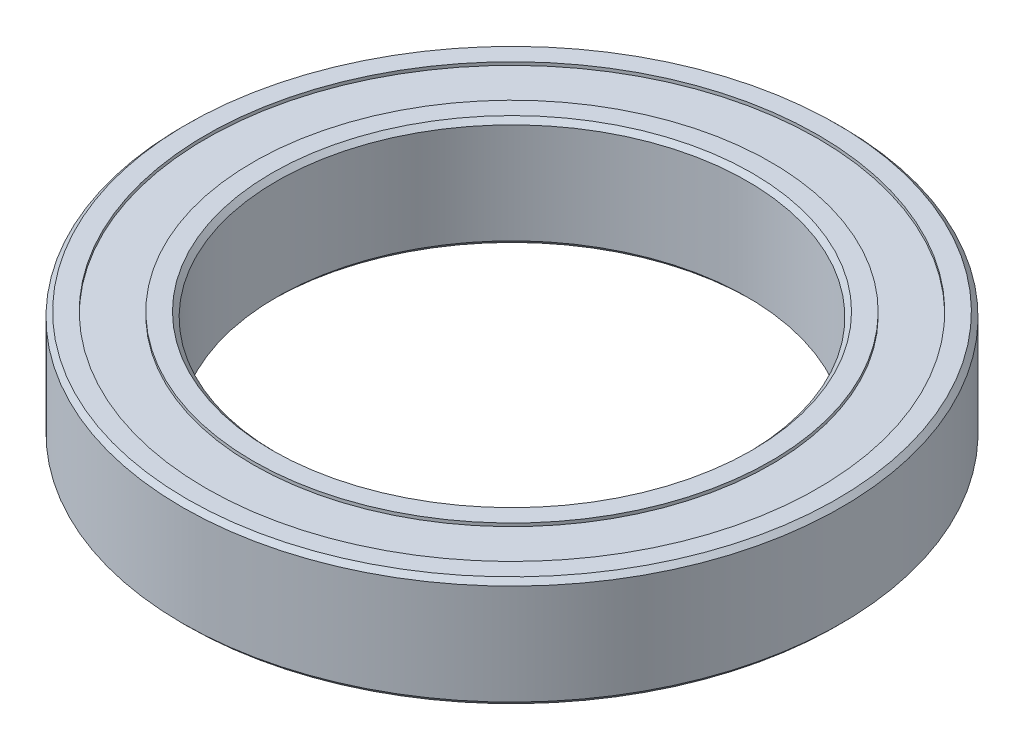
from build123d import *

# Parameters (mm, degrees)
SKETCH1_R           = 21
SKETCH1_R_2         = 15
BOSS_EXTRUDE1_DEPTH = 7
SKETCH2_R           = 19.5
SKETCH2_R_2         = 16.5
CUT_EXTRUDE1_DEPTH  = 0.2
CHAMFER1_SIZE       = 0.3
CUT_EXTRUDE2_START  = -0.2
SKETCH3_R           = 19.5
SKETCH3_R_2         = 16.5
CUT_EXTRUDE2_DEPTH  = 0.2


with BuildPart() as part:
    # Sketch1 → Boss-Extrude1 (new body)
    with BuildSketch(Plane(origin=(0, 0, 0), x_dir=(1, 0, 0), z_dir=(0, 1, 0))):
        with Locations(Location((0, 0, 0), (0, 0, 270))):
            Circle(SKETCH1_R)
        with Locations(Location((0, 0, 0), (0, 0, 270))):
            Circle(SKETCH1_R_2, mode=Mode.SUBTRACT)
    extrude(amount=BOSS_EXTRUDE1_DEPTH)

    # Sketch2 → Cut-Extrude1 (cut)
    with BuildSketch(Plane(origin=(0, 7, 0), x_dir=(1, 0, 0), z_dir=(0, 1, 0))):
        with Locations(Location((0, 0, 0), (0, 0, 270))):
            Circle(SKETCH2_R)
        with Locations(Location((0, 0, 0), (0, 0, 270))):
            Circle(SKETCH2_R_2, mode=Mode.SUBTRACT)
    extrude(amount=-CUT_EXTRUDE1_DEPTH, mode=Mode.SUBTRACT)

    # Chamfer1
    chamfer1_edges = [part.edges().sort_by_distance(p)[0] for p in [
        (0, 0, -21),
        (0, 7, -21),
        (0, 0, -15),
        (0, 7, -15),
    ]]
    chamfer(chamfer1_edges, length=CHAMFER1_SIZE)

    # Sketch3 → Cut-Extrude2 (cut)
    with BuildSketch(Plane.XZ.offset(CUT_EXTRUDE2_START)):
        with Locations(Location((0, 0, 0), (0, 0, 90))):
            Circle(SKETCH3_R)
        with Locations(Location((0, 0, 0), (0, 0, 90))):
            Circle(SKETCH3_R_2, mode=Mode.SUBTRACT)
    extrude(amount=CUT_EXTRUDE2_DEPTH, mode=Mode.SUBTRACT)


solid = part.part
